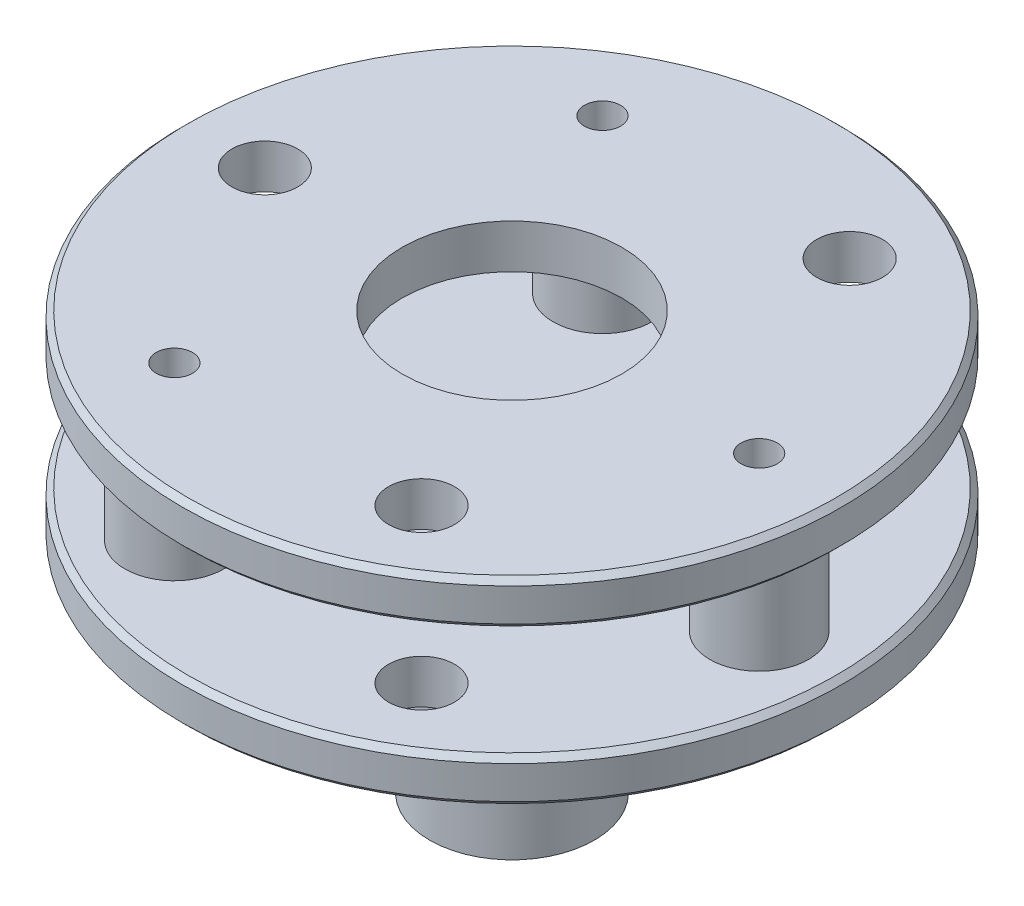
from build123d import *

# Parameters (mm, degrees)
SKETCH_1_R          = 60
EXTRUDE_1_DEPTH     = 8
SKETCH_3_R          = 9
EXTRUDE_3_DEPTH     = 36
SKETCH_4_R          = 60
EXTRUDE_4_DEPTH     = 8
SKETCH_5_R          = 15
EXTRUDE_5_DEPTH     = 48
SKETCH_6_R          = 3.3
CUT_EXTRUDE_1_DEPTH = 114.912246927
SKETCH_7_R          = 6
CUT_EXTRUDE_2_DEPTH = 114.912246927
SKETCH_8_R          = 20
CUT_EXTRUDE_3_DEPTH = 8
SKETCH_9_R          = 4.25
CUT_EXTRUDE_4_DEPTH = 20
CHAMFER_1_SIZE      = 1


with BuildPart() as part:
    # 草图1 → 凸台-拉伸1 (new body)
    with BuildSketch(Plane(origin=(0, 40, 0), x_dir=(1, 0, 0), z_dir=(0, 1, 0))):
        with Locations(Location((0, 0, 0), (0, 0, 270))):
            Circle(SKETCH_1_R)
    extrude(amount=EXTRUDE_1_DEPTH)

    # 草图3 → 凸台-拉伸3 (add)
    with BuildSketch(Plane(origin=(0, 40, 0), x_dir=(1, 0, 0), z_dir=(0, 1, 0))):
        with Locations(Location((45, 0, 0), (0, 0, 270))):
            Circle(SKETCH_3_R)
        with Locations(Location((-22.5, -38.971143, 0), (0, 0, 270))):
            Circle(SKETCH_3_R)
        with Locations(Location((-22.5, 38.971143, 0), (0, 0, 270))):
            Circle(SKETCH_3_R)
    extrude(amount=EXTRUDE_3_DEPTH)

    # 草图4 → 凸台-拉伸4 (add)
    with BuildSketch(Plane(origin=(0, 68, 0), x_dir=(1, 0, 0), z_dir=(0, 1, 0))):
        with Locations(Location((0, 0, 0), (0, 0, 270))):
            Circle(SKETCH_4_R)
    extrude(amount=EXTRUDE_4_DEPTH)

    # 草图5 → 凸台-拉伸5 (add)
    with BuildSketch(Plane(origin=(0, 0, 0), x_dir=(1, 0, 0), z_dir=(0, 1, 0))):
        with Locations(Location((0, 0, 0), (0, 0, 270))):
            Circle(SKETCH_5_R)
    extrude(amount=EXTRUDE_5_DEPTH)

    # 草图6 → 切除-拉伸1 (cut, through all)
    with BuildSketch(Plane(origin=(0, 76, 0), x_dir=(1, 0, 0), z_dir=(0, 1, 0))):
        with Locations(Location((45, 0, 0), (0, 0, 270))):
            Circle(SKETCH_6_R)
        with Locations(Location((-22.5, -38.971143, 0), (0, 0, 270))):
            Circle(SKETCH_6_R)
        with Locations(Location((-22.5, 38.971143, 0), (0, 0, 270))):
            Circle(SKETCH_6_R)
    extrude(amount=-CUT_EXTRUDE_1_DEPTH, mode=Mode.SUBTRACT)

    # 草图7 → 切除-拉伸2 (cut, through all)
    with BuildSketch(Plane(origin=(0, 76, 0), x_dir=(1, 0, 0), z_dir=(0, 1, 0))):
        with Locations(Location((22.5, -38.971143, 0), (0, 0, 270))):
            Circle(SKETCH_7_R)
        with Locations(Location((-45, 0, 0), (0, 0, 270))):
            Circle(SKETCH_7_R)
        with Locations(Location((22.5, 38.971143, 0), (0, 0, 270))):
            Circle(SKETCH_7_R)
    extrude(amount=-CUT_EXTRUDE_2_DEPTH, mode=Mode.SUBTRACT)

    # 草图8 → 切除-拉伸3 (cut)
    with BuildSketch(Plane(origin=(0, 76, 0), x_dir=(1, 0, 0), z_dir=(0, 1, 0))):
        with Locations(Location((0, 0, 0), (0, 0, 270))):
            Circle(SKETCH_8_R)
    extrude(amount=-CUT_EXTRUDE_3_DEPTH, mode=Mode.SUBTRACT)

    # 草图9 → 切除-拉伸4 (cut)
    with BuildSketch(Plane(origin=(0, 0, 0), x_dir=(1, 0, 0), z_dir=(0, 1, 0))):
        with Locations(Location((0, 0, 0), (0, 0, 270))):
            Circle(SKETCH_9_R)
    extrude(amount=CUT_EXTRUDE_4_DEPTH, mode=Mode.SUBTRACT)

    # 倒角1
    chamfer_1_edges = [part.edges().sort_by_distance(p)[0] for p in [
        (0, 40, -60),
        (0, 68, -60),
        (0, 76, -60),
        (0, 48, -60),
    ]]
    chamfer(chamfer_1_edges, length=CHAMFER_1_SIZE)


solid = part.part
